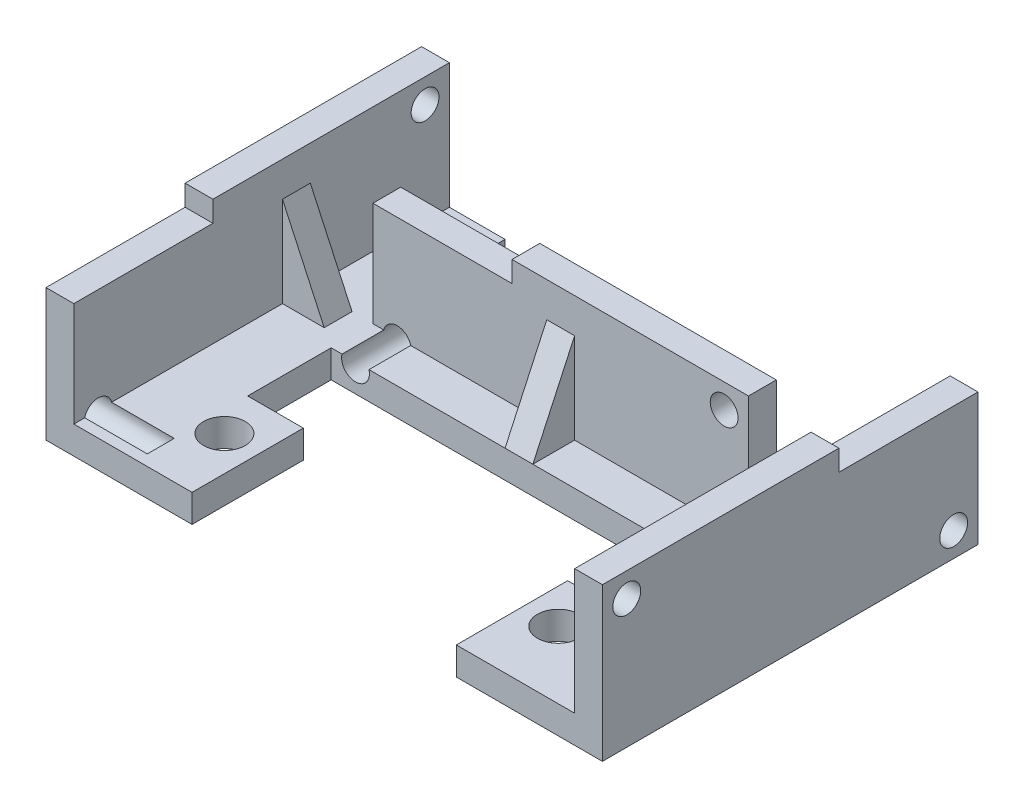
from build123d import *

# Parameters (mm, degrees)
BOSS_EXTRUDE1_DEPTH = 11
CUT_EXTRUDE1_DEPTH  = 9
SKETCH3_W           = 10
SKETCH3_H           = 1.5
CUT_EXTRUDE2_DEPTH  = 9
SKETCH4_W           = 10
SKETCH4_H           = 1.5
CUT_EXTRUDE3_DEPTH  = 9
SKETCH5_W           = 10
SKETCH5_H           = 1.5
CUT_EXTRUDE4_DEPTH  = 9
SKETCH6_R           = 1
CUT_EXTRUDE5_DEPTH  = 9
SKETCH7_R           = 1
CUT_EXTRUDE6_DEPTH  = 9
SKETCH8_R           = 1
CUT_EXTRUDE10_DEPTH = 9
BOSS_EXTRUDE2_DEPTH = 1
SKETCH11_W          = 0.5
SKETCH11_H          = 8
CUT_EXTRUDE12_DEPTH = 30.017236257
BOSS_EXTRUDE3_DEPTH = 2
SKETCH13_W          = 4
SKETCH13_H          = 8
BOSS_EXTRUDE4_DEPTH = 2
SKETCH14_R          = 1.5
CUT_EXTRUDE13_DEPTH = 10


with BuildPart() as part:
    # Sketch1 → Boss-Extrude1 (new body)
    with BuildSketch(Plane(origin=(0, 0, 0), x_dir=(1, 0, 0), z_dir=(0, 1, 0))):
        Polygon((-13.5, 0), (13.5, 0), (13.5, 8), (20, 8), (20, -19), (13.5, -19), (13.5, -5), (-13.5, -5), (-13.5, -19), (-20, -19), (-20, 8), (-13.5, 8), align=None)
    extrude(amount=BOSS_EXTRUDE1_DEPTH)

    # Sketch2 → Cut-Extrude1 (cut)
    with BuildSketch(Plane(origin=(0, 11, 0), x_dir=(1, 0, 0), z_dir=(0, 1, 0))):
        Polygon((-18, 8), (-18, -19), (-13.5, -19), (-13.5, -5), (13.5, -5), (13.5, -19), (18, -19), (18, 8), (13.5, 8), (13.5, -2), (-13.5, -2), (-13.5, 8), align=None)
    extrude(amount=-CUT_EXTRUDE1_DEPTH, mode=Mode.SUBTRACT)

    # Sketch3 → Cut-Extrude2 (cut)
    with BuildSketch(Plane.XY.offset(2)):
        with Locations((-8.5, 10.25)):
            Rectangle(SKETCH3_W, SKETCH3_H)
    extrude(amount=-CUT_EXTRUDE2_DEPTH, mode=Mode.SUBTRACT)

    # Sketch4 → Cut-Extrude3 (cut)
    with BuildSketch(Plane.ZY.offset(-18)):
        with Locations((-3, 10.25)):
            Rectangle(SKETCH4_W, SKETCH4_H)
    extrude(amount=-CUT_EXTRUDE3_DEPTH, mode=Mode.SUBTRACT)

    # Sketch5 → Cut-Extrude4 (cut)
    with BuildSketch(Plane(origin=(-18, 0, 0), x_dir=(0, 0, -1), z_dir=(1, 0, 0))):
        with Locations((-14, 10.25)):
            Rectangle(SKETCH5_W, SKETCH5_H)
    extrude(amount=-CUT_EXTRUDE4_DEPTH, mode=Mode.SUBTRACT)

    # Sketch6 → Cut-Extrude5 (cut)
    with BuildSketch(Plane(origin=(0, 0, 0), x_dir=(-1, 0, 0), z_dir=(0, 0, -1))):
        with Locations((11.75, 1.75)):
            Circle(SKETCH6_R)
        with Locations((-11.75, 9.25)):
            Circle(SKETCH6_R)
    extrude(amount=-CUT_EXTRUDE5_DEPTH, mode=Mode.SUBTRACT)

    # Sketch7 → Cut-Extrude6 (cut)
    with BuildSketch(Plane(origin=(20, 0, 0), x_dir=(0, 0, -1), z_dir=(1, 0, 0))):
        with Locations((6.25, 1.75)):
            Circle(SKETCH7_R)
        with Locations((-17.25, 9.25)):
            Circle(SKETCH7_R)
    extrude(amount=-CUT_EXTRUDE6_DEPTH, mode=Mode.SUBTRACT)

    # Sketch8 → Cut-Extrude10 (cut)
    with BuildSketch(Plane.ZY.offset(20)):
        with Locations((17.25, 1.75)):
            Circle(SKETCH8_R)
        with Locations((-6.25, 9.25)):
            Circle(SKETCH8_R)
    extrude(amount=-CUT_EXTRUDE10_DEPTH, mode=Mode.SUBTRACT)

    # Sketch10 → Boss-Extrude2 (add, symmetric)
    with BuildSketch(Plane(origin=(0, 0, 0), x_dir=(0, 0, -1), z_dir=(1, 0, 0))):
        Polygon((-5, 2), (-2, 2), (-2, 8.5), align=None)
    extrude(amount=BOSS_EXTRUDE2_DEPTH, both=True)

    # Sketch11 → Cut-Extrude12 (cut, through all)
    with BuildSketch(Plane(origin=(0, 2, 0), x_dir=(1, 0, 0), z_dir=(0, 1, 0))):
        with Locations((-13.75, 4)):
            Rectangle(SKETCH11_W, SKETCH11_H)
        with Locations((13.75, 4)):
            Rectangle(SKETCH11_W, SKETCH11_H)
    extrude(amount=-CUT_EXTRUDE12_DEPTH, mode=Mode.SUBTRACT)

    # Sketch12 → Boss-Extrude3 (add)
    with BuildSketch(Plane.XY.offset(2)):
        Polygon((-18, 8.5), (-15, 2), (-18, 2), align=None)
        Polygon((18, 2), (18, 8.5), (15, 2), align=None)
    extrude(amount=BOSS_EXTRUDE3_DEPTH)

    # Sketch13 → Boss-Extrude4 (add)
    with BuildSketch(Plane(origin=(0, 2, 0), x_dir=(1, 0, 0), z_dir=(0, 1, 0))):
        with Locations((11.5, -15)):
            Rectangle(SKETCH13_W, SKETCH13_H)
        with Locations((-11.5, -15)):
            Rectangle(SKETCH13_W, SKETCH13_H)
    extrude(amount=-BOSS_EXTRUDE4_DEPTH)

    # Sketch14 → Cut-Extrude13 (cut)
    with BuildSketch(Plane(origin=(0, 0, 0), x_dir=(-1, 0, 0), z_dir=(0, -1, 0))):
        with Locations(Location((-12, -14.174463975, 0), (0, 0, 90))):
            Circle(SKETCH14_R)
        with Locations(Location((12, -14.174463975, 0), (0, 0, 270))):
            Circle(SKETCH14_R)
    extrude(amount=-CUT_EXTRUDE13_DEPTH, mode=Mode.SUBTRACT)


solid = part.part
